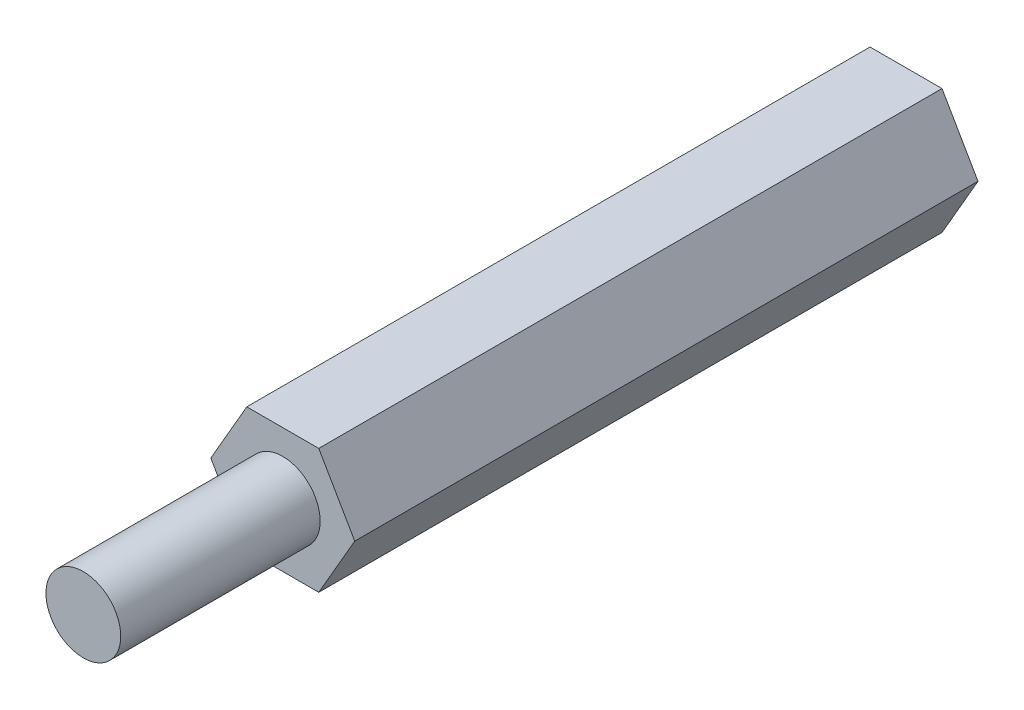
from build123d import *

# Parameters (mm, degrees)
BOSS_EXTRU_1_DEPTH      = 25
ESQUISSE2_R             = 1.5
BOSS_EXTRU_2_DEPTH      = 8
ESQUISSE3_R             = 1.5
ENL_V_MAT_EXTRU_1_DEPTH = 8


with BuildPart() as part:
    # Esquisse1 → Boss.-Extru.1 (new body)
    with BuildSketch(Plane.XY):
        Polygon((2.886751346, 0), (1.443375673, 2.5), (-1.443375673, 2.5), (-2.886751346, 0), (-1.443375673, -2.5), (1.443375673, -2.5), align=None)
    extrude(amount=BOSS_EXTRU_1_DEPTH)

    # Esquisse2 → Boss.-Extru.2 (add)
    with BuildSketch(Plane.XY.offset(25)):
        Circle(ESQUISSE2_R)
    extrude(amount=BOSS_EXTRU_2_DEPTH)

    # Esquisse3 → Enlèv. mat.-Extru.1 (cut)
    with BuildSketch(Plane(origin=(0, 0, 0), x_dir=(-1, 0, 0), z_dir=(0, 0, -1))):
        with Locations(Location((0, 0, 0), (0, 0, 180))):
            Circle(ESQUISSE3_R)
    extrude(amount=-ENL_V_MAT_EXTRU_1_DEPTH, mode=Mode.SUBTRACT)


solid = part.part
